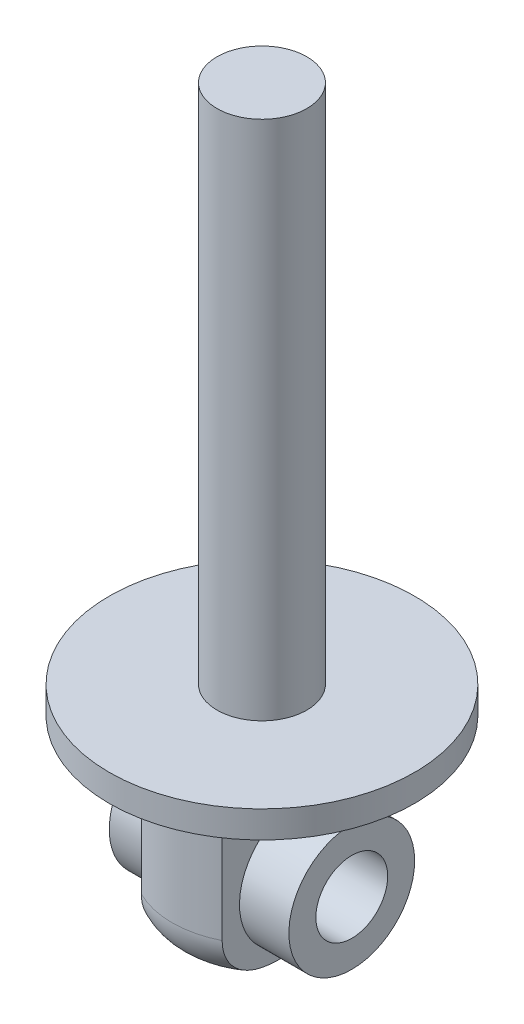
from build123d import *
from build123d.topology import SkipClean

# Parameters (mm, degrees)
SKETCH1_R           = 17
BOSS_EXTRUDE1_DEPTH = 3
SKETCH2_R           = 5
BOSS_EXTRUDE2_DEPTH = 58
SKETCH3_R           = 10
BOSS_EXTRUDE3_DEPTH = 20
FILLET1_R           = 5
CUT_EXTRUDE1_START  = -8.930286
SKETCH4_W           = 7.220401321
SKETCH4_H           = 16.086512415
CUT_EXTRUDE1_DEPTH  = 17.860572
SKETCH5_R           = 4
CUT_EXTRUDE2_DEPTH  = 20
SKETCH6_R           = 7
SKETCH6_R_2         = 4
BOSS_EXTRUDE4_DEPTH = 10


with BuildPart() as part:
    # Sketch1 → Boss-Extrude1 (new body)
    with BuildSketch(Plane(origin=(0, 0, 0), x_dir=(1, 0, 0), z_dir=(0, 1, 0))):
        with Locations(Location((0, 0, 0), (0, 0, 270))):
            Circle(SKETCH1_R)
    extrude(amount=BOSS_EXTRUDE1_DEPTH)

    # Sketch2 → Boss-Extrude2 (add)
    with BuildSketch(Plane(origin=(0, 3, 0), x_dir=(1, 0, 0), z_dir=(0, 1, 0))):
        with Locations(Location((0, 0, 0), (0, 0, 90))):
            Circle(SKETCH2_R)
    extrude(amount=BOSS_EXTRUDE2_DEPTH)

    # Sketch3 → Boss-Extrude3 (add)
    with BuildSketch(Plane.XZ):
        with Locations(Location((0, 0, 0), (0, 0, 90))):
            Circle(SKETCH3_R)
    extrude(amount=BOSS_EXTRUDE3_DEPTH)

    # Fillet1
    fillet1_edges = [part.edges().sort_by_distance(p)[0] for p in [
        (0, -20, -10),
    ]]
    fillet(fillet1_edges, radius=FILLET1_R)

    # Sketch4 → Cut-Extrude1 (cut)
    with BuildSketch(Plane.XY.offset(CUT_EXTRUDE1_START)):
        with Locations((8.110200661, -11.956743792)):
            Rectangle(SKETCH4_W, SKETCH4_H)
        with Locations((-8.110200661, -11.956743792)):
            Rectangle(SKETCH4_W, SKETCH4_H)
    extrude(amount=CUT_EXTRUDE1_DEPTH, mode=Mode.SUBTRACT)

    # Sketch5 → Cut-Extrude2 (cut)
    with BuildSketch(Plane(origin=(4.5, 0, 0), x_dir=(0, 0, -1), z_dir=(1, 0, 0))):
        with Locations(Location((0, -12.5, 0), (0, 0, 90))):
            Circle(SKETCH5_R)
    extrude(amount=-CUT_EXTRUDE2_DEPTH, mode=Mode.SUBTRACT)

    # Sketch6 → Boss-Extrude4 (add, symmetric)
    with SkipClean():  # the faces are left unmerged after this step: merging them gives an invalid solid
        with BuildSketch(Plane(origin=(0, 0, 0), x_dir=(0, 0, -1), z_dir=(1, 0, 0))):
            with Locations(Location((0, -12.5, 0), (0, 0, 90))):
                Circle(SKETCH6_R)
            with Locations((0, -12.5)):
                Circle(SKETCH6_R_2, mode=Mode.SUBTRACT)
        extrude(amount=BOSS_EXTRUDE4_DEPTH, both=True)


solid = part.part
